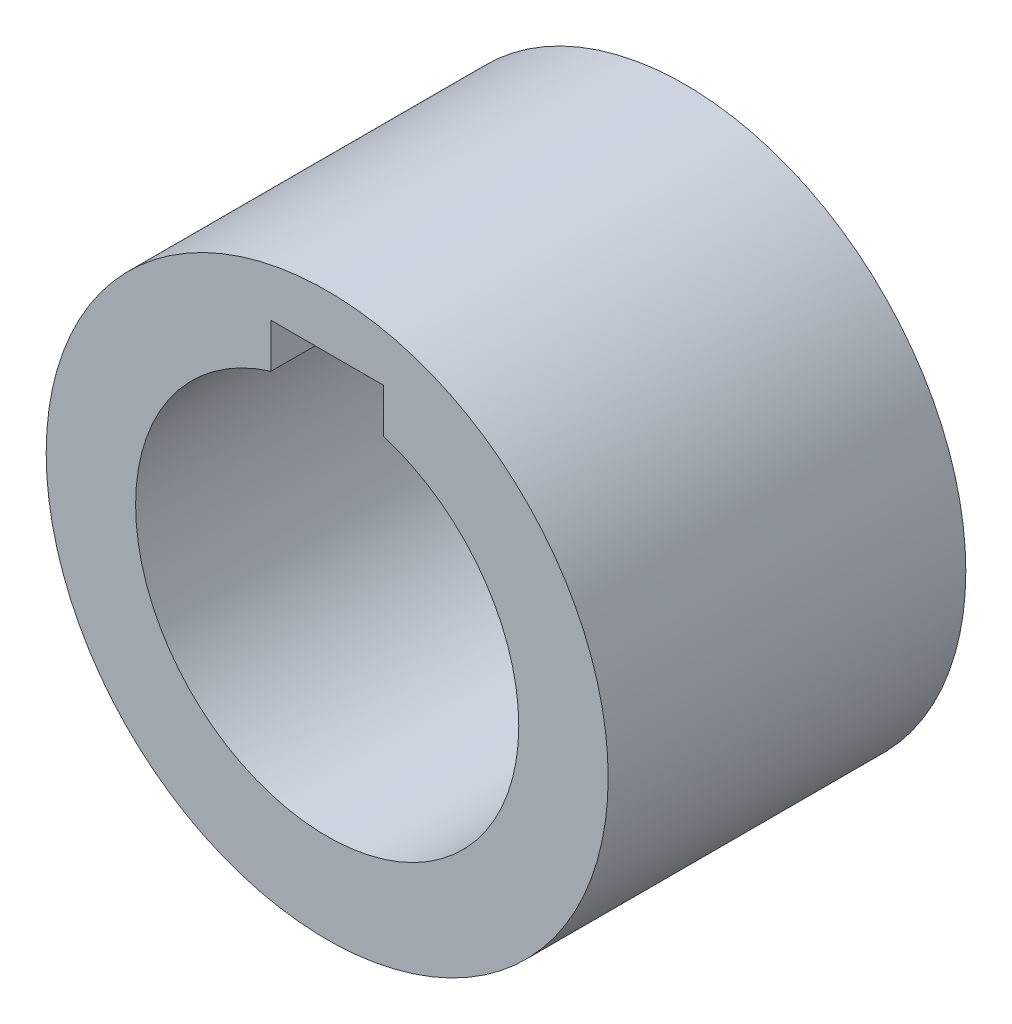
from build123d import *

# Parameters (mm, degrees)
SKETCH1_R               = 55
SKETCH1_R_2             = 37.5
BOSS_EXTRUDE1_DEPTH     = 70
CUT_EXTRUDE1_DEPTH      = 105.642247682
CUT_EXTRUDE1_DEPTH_BACK = 105.642247682
SKETCH2_W               = 22
SKETCH2_H               = 14


with BuildPart() as part:
    # Sketch1 → Boss-Extrude1 (new body)
    with BuildSketch(Plane.XY):
        Circle(SKETCH1_R)
        Circle(SKETCH1_R_2, mode=Mode.SUBTRACT)
    extrude(amount=BOSS_EXTRUDE1_DEPTH)

    # Sketch2 → Cut-Extrude1 (cut, two sides: drawn at the far end of the back side and taken through both)
    with BuildSketch(Plane.XY.offset(70).offset(-CUT_EXTRUDE1_DEPTH_BACK)):
        with Locations((0, 37.5)):
            Rectangle(SKETCH2_W, SKETCH2_H)
    extrude(amount=CUT_EXTRUDE1_DEPTH + CUT_EXTRUDE1_DEPTH_BACK, mode=Mode.SUBTRACT)


solid = part.part
